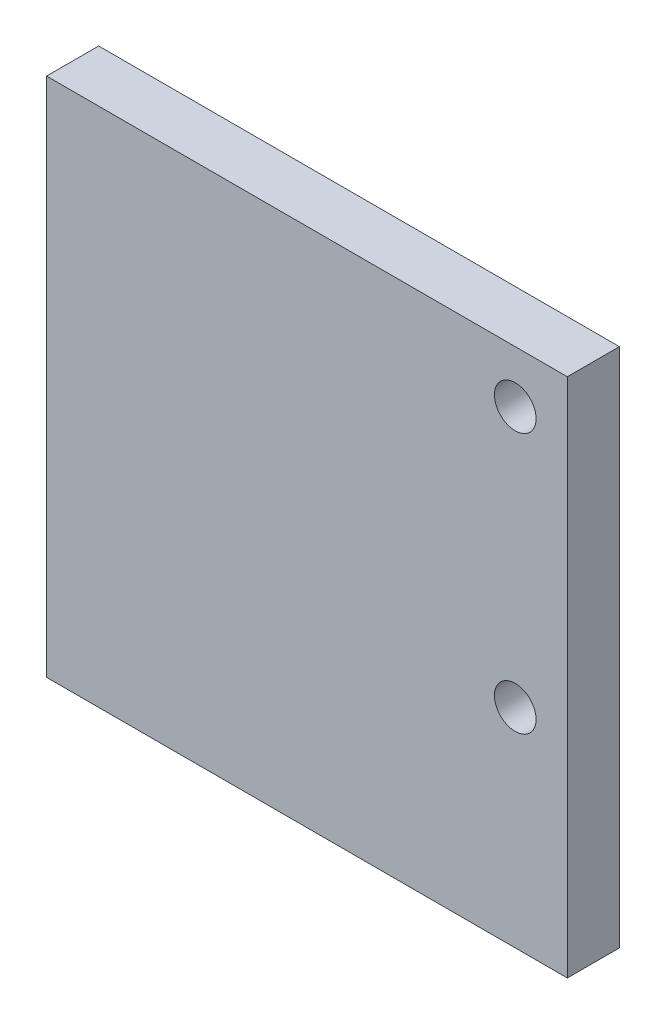
from build123d import *

# Parameters (mm, degrees)
SKETCH1_W           = 100
SKETCH1_H           = 100
BOSS_EXTRUDE1_DEPTH = 10
SKETCH2_R           = 2.5
CUT_EXTRUDE1_DEPTH  = 30
SKETCH3_R           = 4
CUT_EXTRUDE2_DEPTH  = 10


with BuildPart() as part:
    # Sketch1 → Boss-Extrude1 (new body)
    with BuildSketch(Plane.XY):
        with Locations((50, 50)):
            Rectangle(SKETCH1_W, SKETCH1_H)
    extrude(amount=BOSS_EXTRUDE1_DEPTH)

    # Sketch2 → Cut-Extrude1 (cut)
    with BuildSketch(Plane.XZ):
        with Locations(Location((25, 5, 0), (0, 0, 270))):
            Circle(SKETCH2_R)
        with Locations(Location((50, 5, 0), (0, 0, 270))):
            Circle(SKETCH2_R)
        with Locations(Location((75, 5, 0), (0, 0, 270))):
            Circle(SKETCH2_R)
    extrude(amount=-CUT_EXTRUDE1_DEPTH, mode=Mode.SUBTRACT)

    # Sketch3 → Cut-Extrude2 (cut)
    with BuildSketch(Plane.XY.offset(10)):
        with Locations((90, 90)):
            Circle(SKETCH3_R)
        with Locations((90, 40)):
            Circle(SKETCH3_R)
    extrude(amount=-CUT_EXTRUDE2_DEPTH, mode=Mode.SUBTRACT)


solid = part.part
